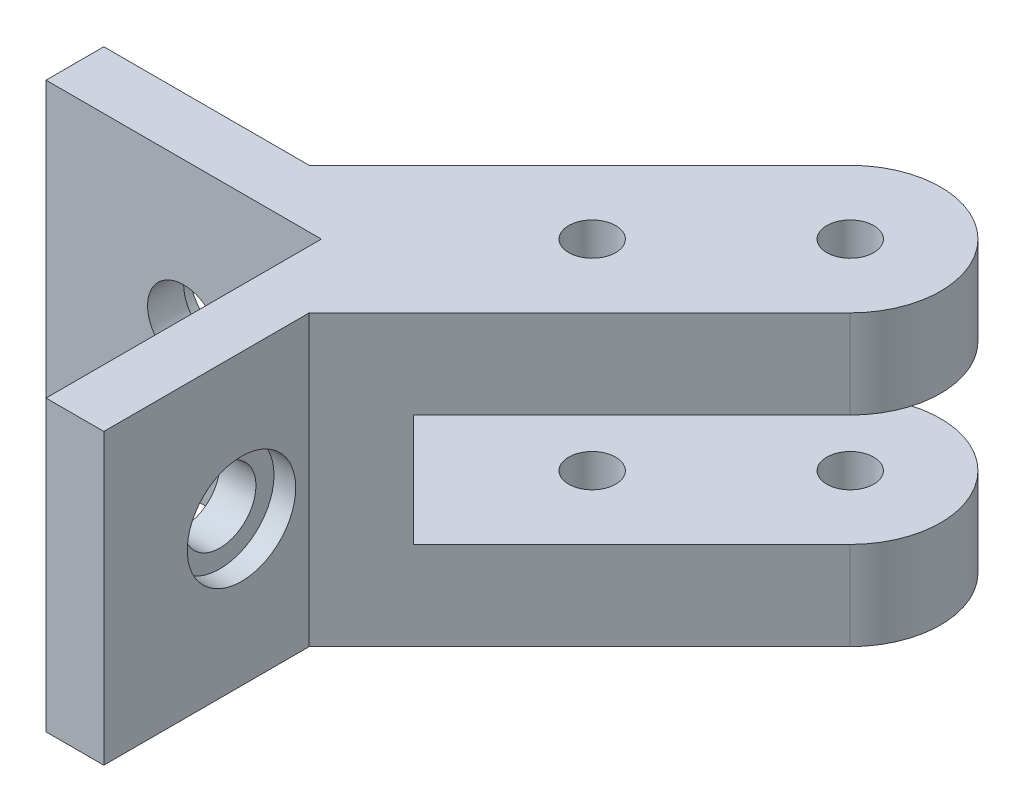
from build123d import *

# Parameters (mm, degrees)
SKETCH2_R               = 3.25
BOSS_EXTRUDE1_DEPTH     = 40
CUT_EXTRUDE1_DEPTH      = 81.126158627
CUT_EXTRUDE1_DEPTH_BACK = 81.126158627
SKETCH4_R               = 5
CUT_EXTRUDE2_DEPTH      = 50
SKETCH6_R               = 5
CUT_EXTRUDE4_DEPTH      = 50
SKETCH7_R               = 7.5
CUT_EXTRUDE5_DEPTH      = 3
CUT_EXTRUDE6_DEPTH      = 5.1
SKETCH5_R               = 7.5
CUT_EXTRUDE7_DEPTH      = 3


with BuildPart() as part:
    # Sketch2 → Boss-Extrude1 (new body)
    with BuildSketch(Plane(origin=(0, 0, 0), x_dir=(1, 0, 0), z_dir=(0, 1, 0))):
        with BuildLine():
            Line((-38.1, 0), (-38.1, 8))
            Line((-38.1, 8), (-9.67766953, 8))
            Line((-9.67766953, 8), (27.753941162, 45.431610691))
            ThreePointArc((27.753941162, 45.431610691), (45.431610691, 45.431610691), (45.431610691, 27.753941162))
            Line((45.431610691, 27.753941162), (8, -9.67766953))
            Line((8, -9.67766953), (8, -38.1))
            Line((8, -38.1), (0, -38.1))
            Line((0, -38.1), (0, 0))
            Line((0, 0), (-38.1, 0))
        make_face()
        with Locations(Location((18.738329701, 18.738329701, 0), (0, 0, 270))):
            Circle(SKETCH2_R, mode=Mode.SUBTRACT)
        with Locations(Location((36.592775926, 36.592775926, 0), (0, 0, 270))):
            Circle(SKETCH2_R, mode=Mode.SUBTRACT)
    extrude(amount=BOSS_EXTRUDE1_DEPTH)

    # Sketch3 → Cut-Extrude1 (cut, two sides: drawn at the far end of the back side and taken through both)
    with BuildSketch(Plane(origin=(0, 0, 0), x_dir=(0, -1, 0), z_dir=(0.7071067811865488, 0, 0.7071067811865464)).offset(-CUT_EXTRUDE1_DEPTH_BACK)):
        Polygon((-12.25, 9), (-27.75, 9), (-27.75, 69), (-35, 69), (-35, 89), (-5, 89), (-5, 69), (-12.25, 69), align=None)
    extrude(amount=CUT_EXTRUDE1_DEPTH + CUT_EXTRUDE1_DEPTH_BACK, mode=Mode.SUBTRACT)

    # Sketch4 → Cut-Extrude2 (cut)
    with BuildSketch(Plane.XY):
        with Locations((-19.05, 20)):
            Circle(SKETCH4_R)
    extrude(amount=-CUT_EXTRUDE2_DEPTH, mode=Mode.SUBTRACT)

    # Sketch6 → Cut-Extrude4 (cut)
    with BuildSketch(Plane.ZY):
        with Locations((19.05, 20)):
            Circle(SKETCH6_R)
    extrude(amount=-CUT_EXTRUDE4_DEPTH, mode=Mode.SUBTRACT)

    # Sketch7 → Cut-Extrude5 (cut)
    with BuildSketch(Plane(origin=(8, 0, 0), x_dir=(0, 0, -1), z_dir=(1, 0, 0))):
        with Locations((-19.05, 20)):
            Circle(SKETCH7_R)
    extrude(amount=-CUT_EXTRUDE5_DEPTH, mode=Mode.SUBTRACT)

    # Sketch10 → Cut-Extrude6 (cut)
    with BuildSketch(Plane(origin=(0, 0, 0), x_dir=(1, 0, 0), z_dir=(0, 1, 0))):
        Polygon((14.574197139, 22.902462264), (13.050018836, 17.214151399), (17.214151399, 13.050018836), (22.902462264, 14.574197139), (24.426640567, 20.262508004), (20.262508004, 24.426640567), align=None)
        Polygon((35.068597624, 30.904465061), (40.756908489, 32.428643364), (42.281086792, 38.116954229), (38.116954229, 42.281086792), (32.428643364, 40.756908489), (30.904465061, 35.068597624), align=None)
    extrude(amount=CUT_EXTRUDE6_DEPTH, mode=Mode.SUBTRACT)

    # Sketch5 → Cut-Extrude7 (cut)
    with BuildSketch(Plane(origin=(0, 0, -8), x_dir=(-1, 0, 0), z_dir=(0, 0, -1))):
        with Locations((19.05, 20)):
            Circle(SKETCH5_R)
    extrude(amount=-CUT_EXTRUDE7_DEPTH, mode=Mode.SUBTRACT)


solid = part.part
